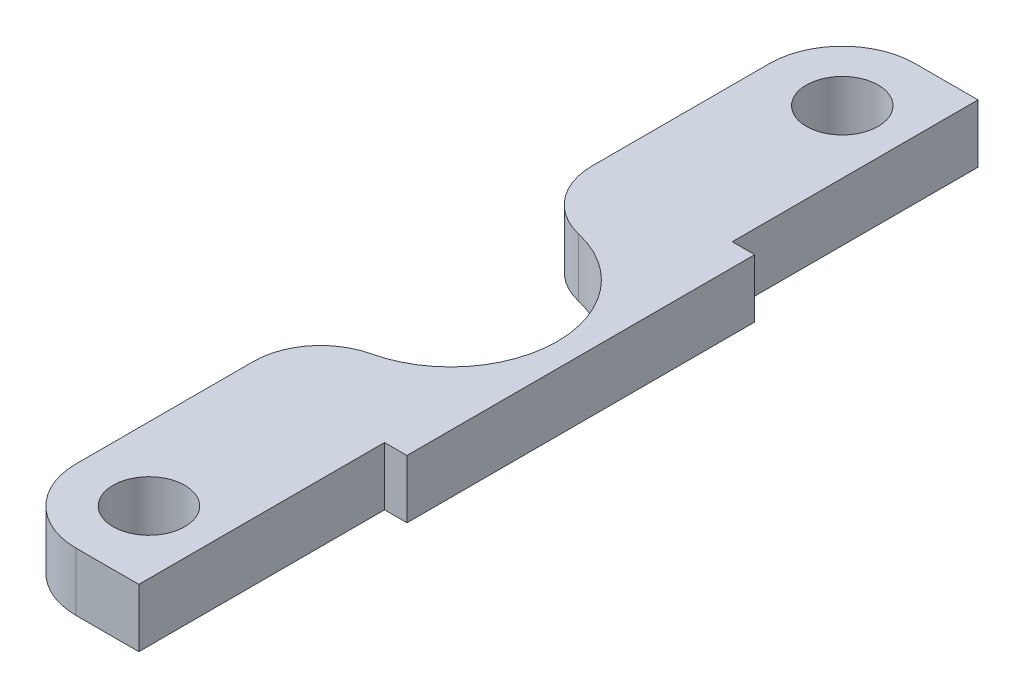
from build123d import *

# Parameters (mm, degrees)
CROQUIS1_R              = 1.6
SALIENTE_EXTRUIR1_DEPTH = 2.6
CROQUIS3_W              = 1
CROQUIS3_H              = 15.5
SALIENTE_EXTRUIR2_DEPTH = 2.6
CORTAR_EXTRUIR1_DEPTH   = 35.458997374
REDONDEO1_R             = 3


with BuildPart() as part:
    # Croquis1 → Saliente-Extruir1 (new body)
    with BuildSketch(Plane(origin=(0, 0, 0), x_dir=(1, 0, 0), z_dir=(0, 1, 0))):
        with BuildLine():
            Line((-3.25, 30.9), (-3.25, 0))
            ThreePointArc((-3.25, 0), (-2.298097039, -2.298097039), (0, -3.25))
            Line((0, -3.25), (2.8, -3.25))
            Line((2.8, -3.25), (2.8, 34.15))
            Line((2.8, 34.15), (0, 34.15))
            ThreePointArc((0, 34.15), (-2.298097039, 33.198097039), (-3.25, 30.9))
        make_face()
        with Locations(Location((0, 0, 0), (0, 0, 270))):
            Circle(CROQUIS1_R, mode=Mode.SUBTRACT)
        with Locations(Location((0, 30.9, 0), (0, 0, 270))):
            Circle(CROQUIS1_R, mode=Mode.SUBTRACT)
    extrude(amount=SALIENTE_EXTRUIR1_DEPTH)

    # Croquis3 → Saliente-Extruir2 (add)
    with BuildSketch(Plane(origin=(0, 2.6, 0), x_dir=(1, 0, 0), z_dir=(0, 1, 0))):
        with Locations((3.3, 15.45)):
            Rectangle(CROQUIS3_W, CROQUIS3_H)
    extrude(amount=-SALIENTE_EXTRUIR2_DEPTH)

    # Croquis2 → Cortar-Extruir1 (cut, through all)
    with BuildSketch(Plane(origin=(0, 2.6, 0), x_dir=(1, 0, 0), z_dir=(0, 1, 0))):
        with BuildLine():
            Line((-2, 20.2), (-3.25, 20.2))
            Line((-3.25, 20.2), (-3.25, 10.7))
            Line((-3.25, 10.7), (-2, 10.7))
            ThreePointArc((-2, 10.7), (2.75, 15.45), (-2, 20.2))
        make_face()
    extrude(amount=-CORTAR_EXTRUIR1_DEPTH, mode=Mode.SUBTRACT)

    # Redondeo1
    redondeo1_edges = [part.edges().sort_by_distance(p)[0] for p in [
        (-3.25, 1.3, -10.7),
        (-3.25, 1.3, -20.2),
    ]]
    fillet(redondeo1_edges, radius=REDONDEO1_R)


solid = part.part
